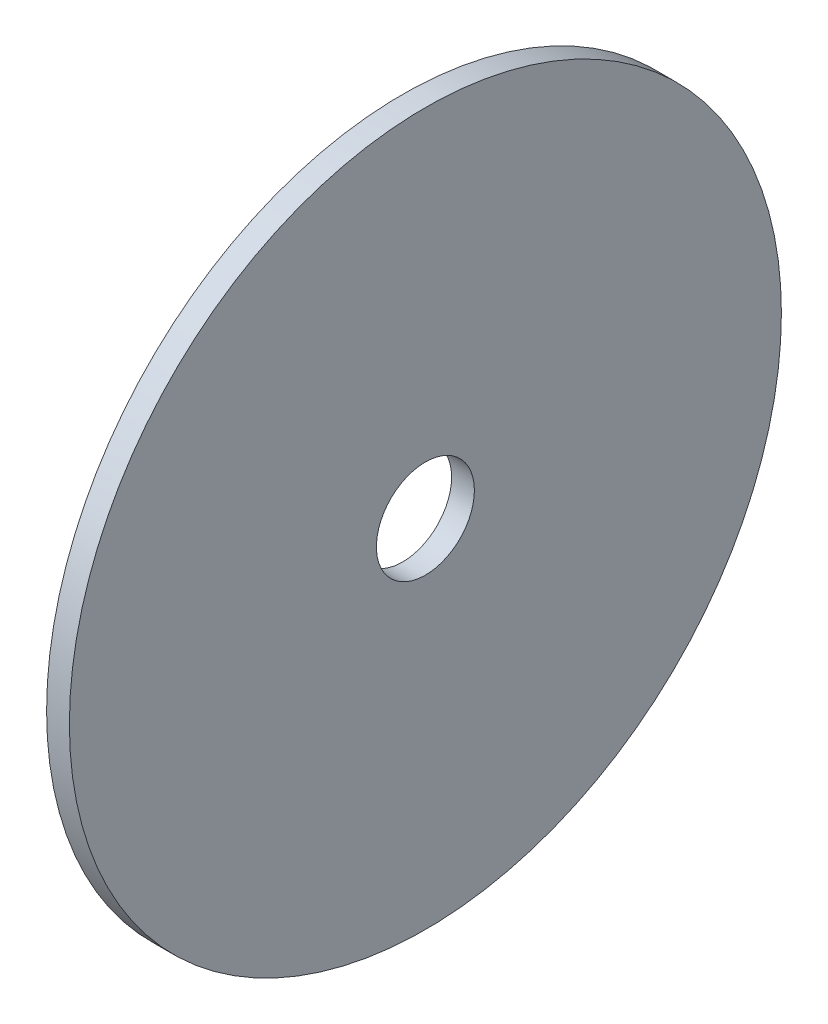
from build123d import *

# Parameters (mm, degrees)
SKETCH1_R           = 31.75
SKETCH1_R_2         = 4.3688
BOSS_EXTRUDE1_DEPTH = 2.032


with BuildPart() as part:
    # Sketch1 → Boss-Extrude1 (new body)
    with BuildSketch(Plane(origin=(0, 0, 0), x_dir=(0, 0, -1), z_dir=(1, 0, 0))):
        Circle(SKETCH1_R)
        Circle(SKETCH1_R_2, mode=Mode.SUBTRACT)
    extrude(amount=BOSS_EXTRUDE1_DEPTH)


solid = part.part
